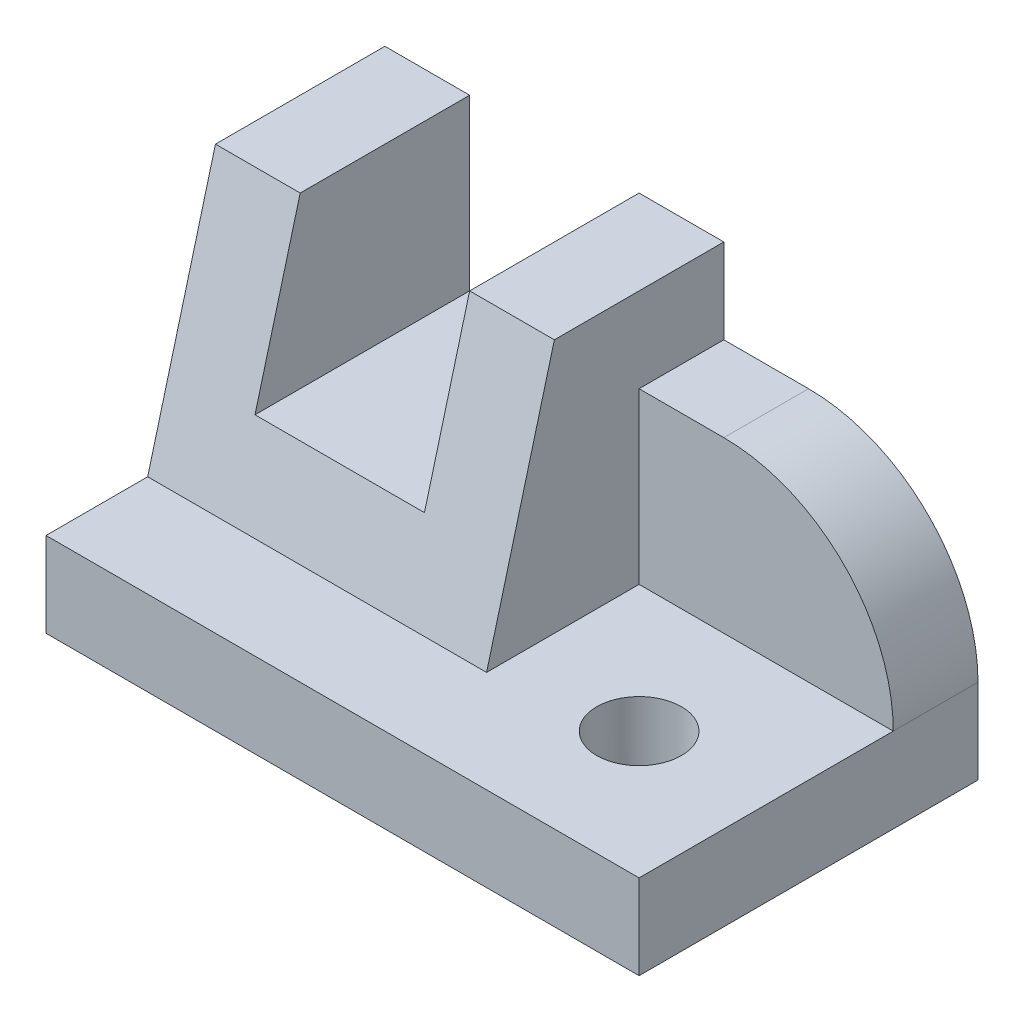
from build123d import *

# Parameters (mm, degrees)
BOSS_EXTRUDE1_DEPTH            = 40
SKETCH2_W                      = 40
SKETCH2_H                      = 30
BOSS_EXTRUDE2_DEPTH            = 20
BOSS_EXTRUDE3_DEPTH            = 30
CUT_EXTRUDE1_DEPTH             = 30
SKETCH5_W                      = 70
SKETCH5_H                      = 40
BOSS_EXTRUDE4_DEPTH            = 10
SKETCH6_W                      = 20
SKETCH6_H                      = 20
CUT_EXTRUDE2_DEPTH             = 91
F_10_0_10_DIAMETER_HOLE1_D     = 10
F_10_0_10_DIAMETER_HOLE1_DEPTH = 40
FILLET1_R                      = 20


with BuildPart() as part:
    # Sketch1 → Boss-Extrude1 (new body)
    with BuildSketch(Plane(origin=(0, 0, 0), x_dir=(0, -1, 0), z_dir=(-1, 0, 0))):
        Polygon((-10, -12), (-40, -20), (-10, -20), align=None)
    extrude(amount=-BOSS_EXTRUDE1_DEPTH)

    # Sketch2 → Boss-Extrude2 (add)
    with BuildSketch(Plane(origin=(0, 0, -20), x_dir=(-1, 0, 0), z_dir=(0, 0, -1))):
        with Locations((-20, 25)):
            Rectangle(SKETCH2_W, SKETCH2_H)
    extrude(amount=BOSS_EXTRUDE2_DEPTH)

    # Sketch3 → Boss-Extrude3 (add)
    with BuildSketch(Plane(origin=(40, 0, 0), x_dir=(0, 0, -1), z_dir=(1, 0, 0))):
        Polygon((40, 10), (0, 10), (20, 40), (40, 40), align=None)
    extrude(amount=BOSS_EXTRUDE3_DEPTH)

    # Sketch4 → Cut-Extrude1 (cut)
    with BuildSketch(Plane(origin=(70, 0, 0), x_dir=(0, 0, -1), z_dir=(1, 0, 0))):
        Polygon((20, 40), (0, 10), (30, 10), (30, 30), (40, 30), (40, 40), align=None)
    extrude(amount=-CUT_EXTRUDE1_DEPTH, mode=Mode.SUBTRACT)

    # Sketch5 → Boss-Extrude4 (add)
    with BuildSketch(Plane.XZ.offset(-10)):
        with Locations((35, -20)):
            Rectangle(SKETCH5_W, SKETCH5_H)
    extrude(amount=BOSS_EXTRUDE4_DEPTH)

    # Sketch6 → Cut-Extrude2 (cut, through all)
    with BuildSketch(Plane(origin=(0, 0, -40), x_dir=(-1, 0, 0), z_dir=(0, 0, -1))):
        with Locations((-20, 30)):
            Rectangle(SKETCH6_W, SKETCH6_H)
    extrude(amount=-CUT_EXTRUDE2_DEPTH, mode=Mode.SUBTRACT)

    # Ø10.0 (10) Diameter Hole1
    with Locations(Plane(origin=(0, 0, 0), x_dir=(-1, 0, 0), z_dir=(0, -1, 0))):
        with Locations((-55, 15)):
            Hole(F_10_0_10_DIAMETER_HOLE1_D / 2, depth=F_10_0_10_DIAMETER_HOLE1_DEPTH)

    # Fillet1
    fillet1_edges = [part.edges().sort_by_distance(p)[0] for p in [
        (70, 30, -35),
    ]]
    fillet(fillet1_edges, radius=FILLET1_R)


solid = part.part
